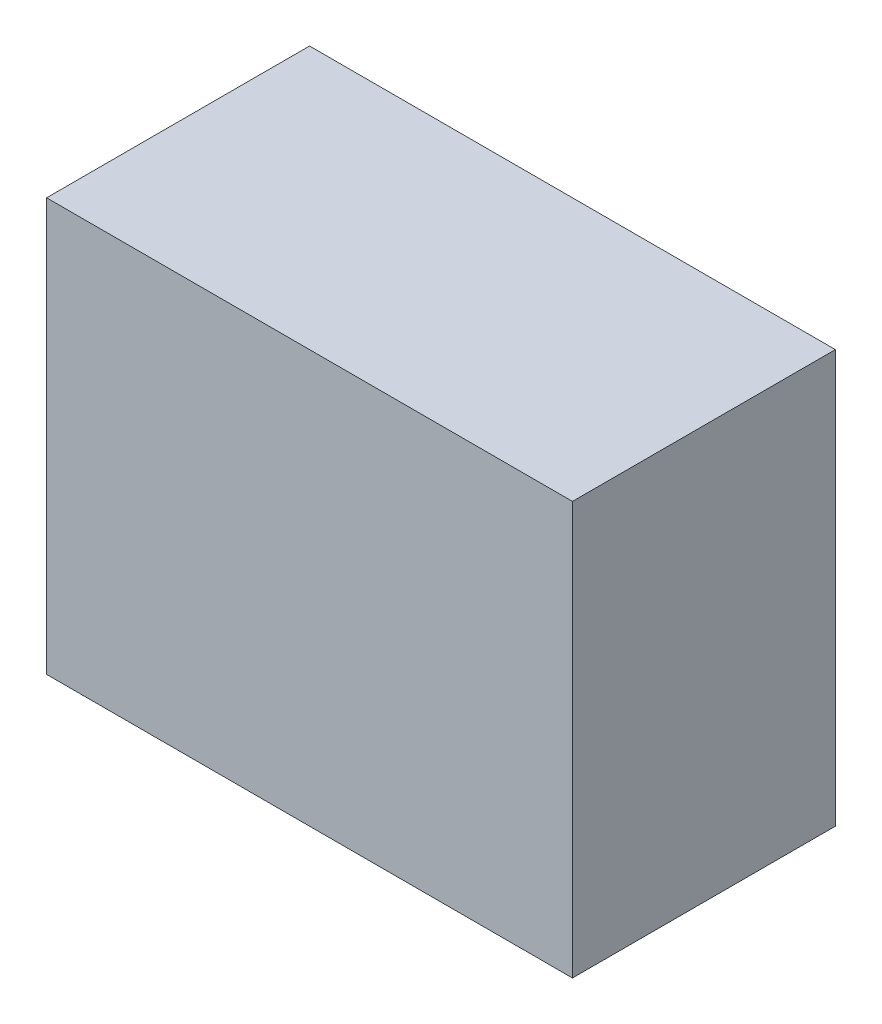
from build123d import *

# Parameters (mm, degrees)
SKETCH1_W           = 50.8
SKETCH1_H           = 25.4
BOSS_EXTRUDE1_DEPTH = 39.875


with BuildPart() as part:
    # Sketch1 → Boss-Extrude1 (new body)
    with BuildSketch(Plane(origin=(0, 0, 0), x_dir=(1, 0, 0), z_dir=(0, 1, 0))):
        Rectangle(SKETCH1_W, SKETCH1_H)
    extrude(amount=BOSS_EXTRUDE1_DEPTH)


solid = part.part
